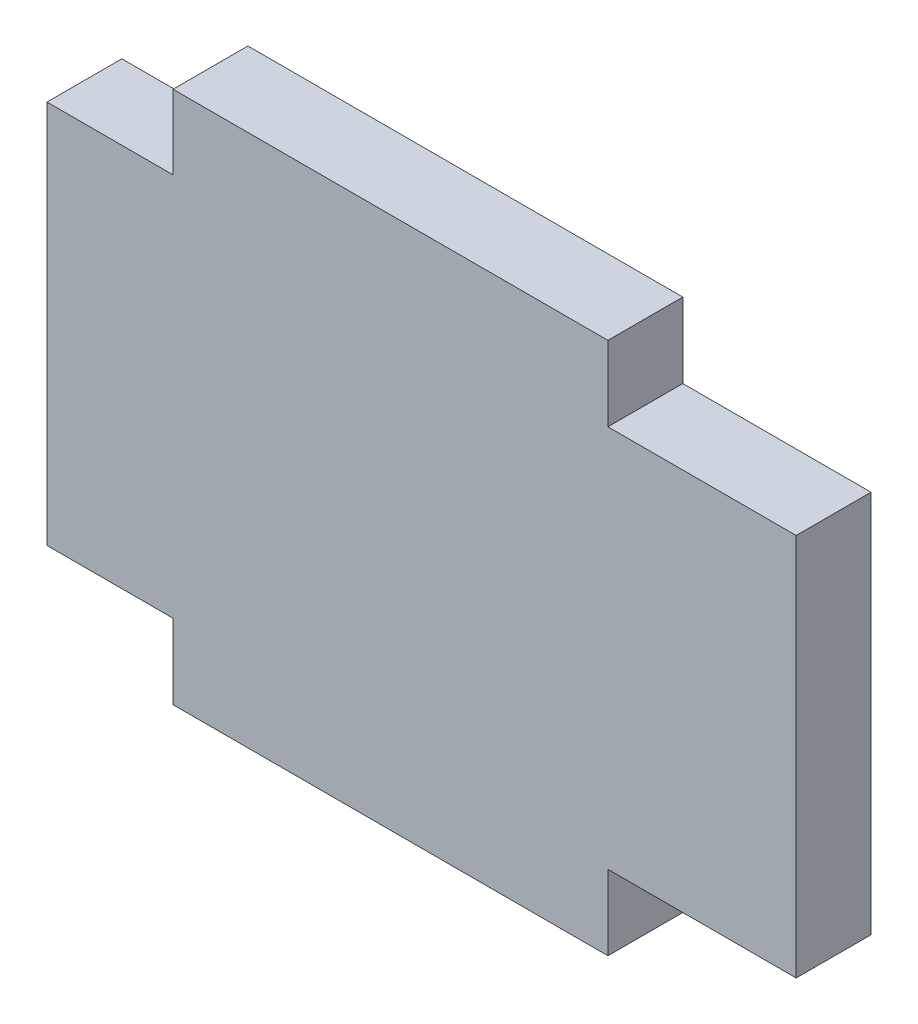
from build123d import *

# Parameters (mm, degrees)
BOSS_EXTRUDE1_DEPTH = 5.08


with BuildPart() as part:
    # Sketch1 → Boss-Extrude1 (new body)
    with BuildSketch(Plane(origin=(0, 0, 0), x_dir=(-1, 0, 0), z_dir=(0, 0, 1))):
        Polygon((87.693593116, 20.706897394), (87.693593116, 25.735685637), (96.246360853, 25.735685637), (96.246360853, 51.786897394), (87.694480523, 51.786897394), (87.694480523, 56.866897394), (58.191245184, 56.866897394), (58.191245184, 51.786897394), (45.419377571, 51.786897394), (45.419377571, 25.786897394), (58.190357776, 25.786897394), (58.190357776, 20.706897394), align=None)
    extrude(amount=BOSS_EXTRUDE1_DEPTH)


solid = part.part
